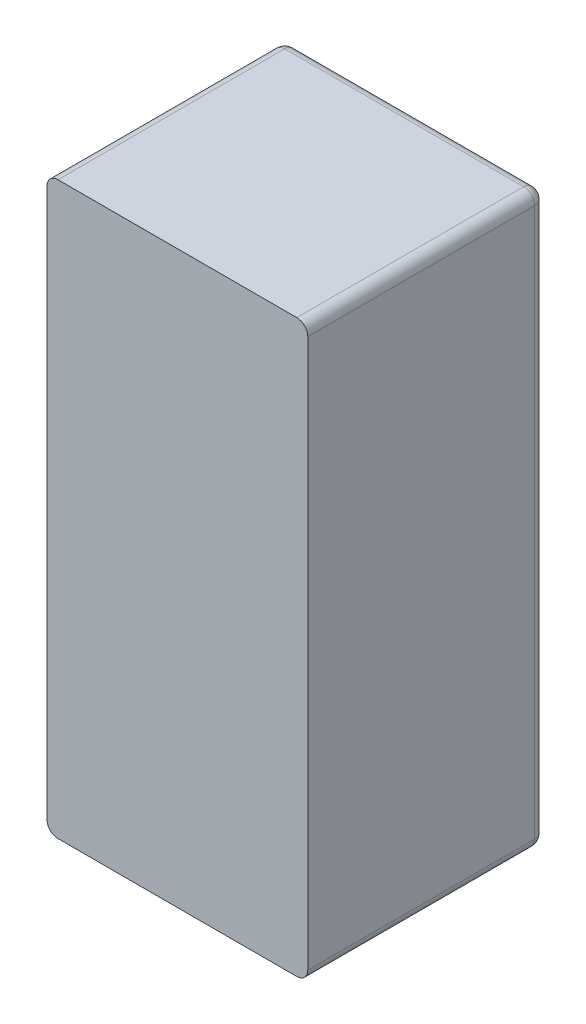
from build123d import *

# Parameters (mm, degrees)
SKETCH1_W           = 237.998
SKETCH1_H           = 216.916
BOSS_EXTRUDE1_DEPTH = 520.7
FILLET1_R           = 10


with BuildPart() as part:
    # Sketch1 → Boss-Extrude1 (new body)
    with BuildSketch(Plane(origin=(0, 0, 0), x_dir=(1, 0, 0), z_dir=(0, 1, 0))):
        with Locations((-118.999, -108.458)):
            Rectangle(SKETCH1_W, SKETCH1_H)
    extrude(amount=BOSS_EXTRUDE1_DEPTH)

    # Fillet1
    fillet1_edges = [part.edges().sort_by_distance(p)[0] for p in [
        (-237.998, 520.7, 108.458),
        (0, 520.7, 108.458),
        (-237.998, 0, 108.458),
        (-118.999, 0, 0),
        (0, 0, 108.458),
        (-237.998, 260.35, 0),
        (0, 260.35, 0),
        (-118.999, 520.7, 0),
    ]]
    fillet(fillet1_edges, radius=FILLET1_R)


solid = part.part
